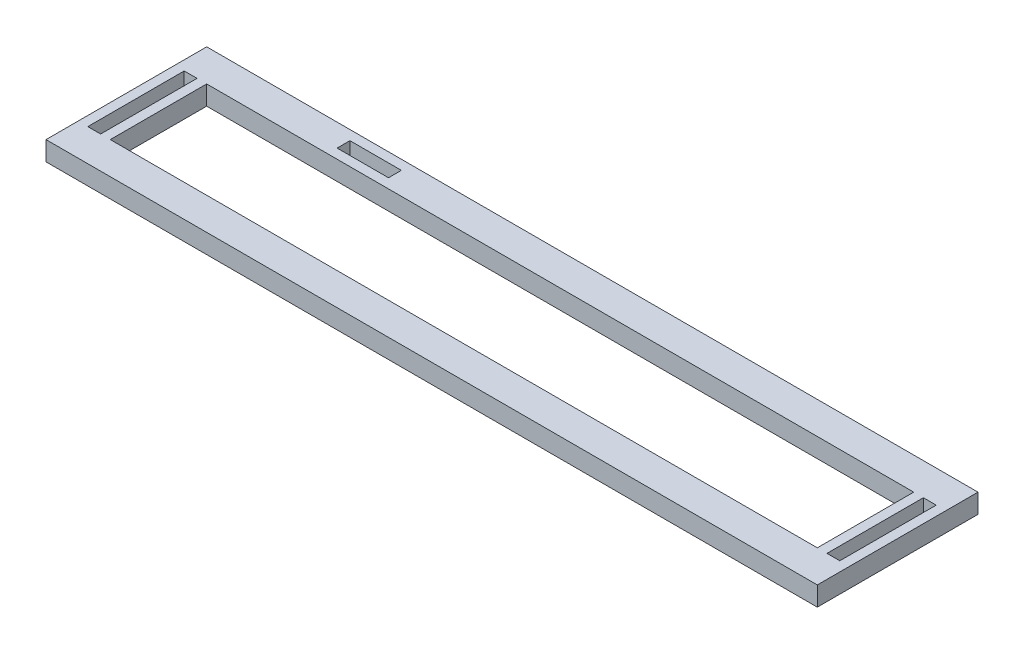
from build123d import *

# Parameters (mm, degrees)
SKETCH1_W           = 120
SKETCH1_H           = 25
SKETCH1_W_2         = 110
SKETCH1_H_2         = 15
SKETCH1_W_3         = 2
SKETCH1_W_4         = 8
SKETCH1_H_3         = 2
BOSS_EXTRUDE1_DEPTH = 3


with BuildPart() as part:
    # Sketch1 → Boss-Extrude1 (new body)
    with BuildSketch(Plane(origin=(0, 0, 0), x_dir=(1, 0, 0), z_dir=(0, 1, 0))):
        with Locations((60, 12.5)):
            Rectangle(SKETCH1_W, SKETCH1_H)
        with Locations((60, 12.5)):
            Rectangle(SKETCH1_W_2, SKETCH1_H_2, mode=Mode.SUBTRACT)
        with Locations((2.5, 12.5)):
            Rectangle(SKETCH1_W_3, SKETCH1_H_2, mode=Mode.SUBTRACT)
        with Locations((117.5, 12.5)):
            Rectangle(SKETCH1_W_3, SKETCH1_H_2, mode=Mode.SUBTRACT)
        with Locations((27.787478482, 22.5)):
            Rectangle(SKETCH1_W_4, SKETCH1_H_3, mode=Mode.SUBTRACT)
    extrude(amount=BOSS_EXTRUDE1_DEPTH)


solid = part.part
